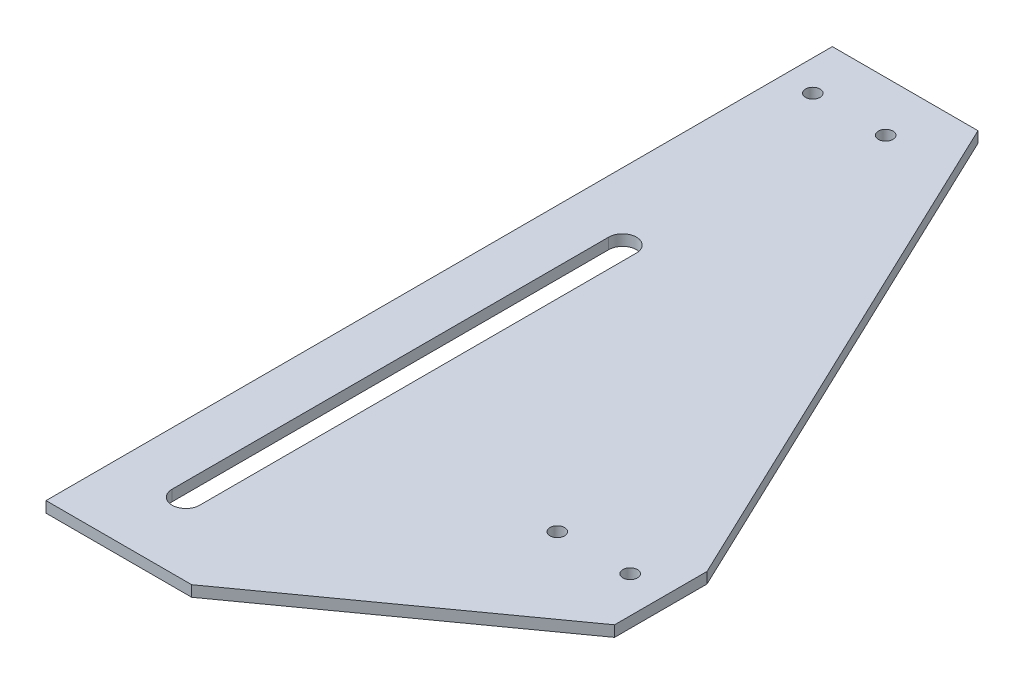
from build123d import *

# Parameters (mm, degrees)
SKETCH1_R           = 1
BOSS_EXTRUDE1_DEPTH = 1.5


with BuildPart() as part:
    # Sketch1 → Boss-Extrude1 (new body)
    with BuildSketch(Plane(origin=(0, 0, 0), x_dir=(1, 0, 0), z_dir=(0, 1, 0))):
        Polygon((-33.800555393, 83.700849363), (0, 12.7), (0, 0), (-33.800555393, -24.25948244), (-53.800555393, -24.25948244), (-53.800555393, 83.700849363), align=None)
        with Locations(Location((-39.6, 76.82, 0), (0, 0, 270))):
            Circle(SKETCH1_R, mode=Mode.SUBTRACT)
        with Locations(Location((-49.6, 76.82, 0), (0, 0, 270))):
            Circle(SKETCH1_R, mode=Mode.SUBTRACT)
        with Locations(Location((-5, 7.14, 0), (0, 0, 270))):
            Circle(SKETCH1_R, mode=Mode.SUBTRACT)
        with Locations(Location((-15, 7.14, 0), (0, 0, 270))):
            Circle(SKETCH1_R, mode=Mode.SUBTRACT)
        with BuildLine():
            Line((-42.7, -14.25948244), (-42.7, 45.700849363))
            ThreePointArc((-42.7, 45.700849363), (-44.6, 47.600849363), (-46.5, 45.700849363))
            Line((-46.5, 45.700849363), (-46.5, -14.25948244))
            ThreePointArc((-46.5, -14.25948244), (-44.6, -16.15948244), (-42.7, -14.25948244))
        make_face(mode=Mode.SUBTRACT)
    extrude(amount=BOSS_EXTRUDE1_DEPTH)


solid = part.part
